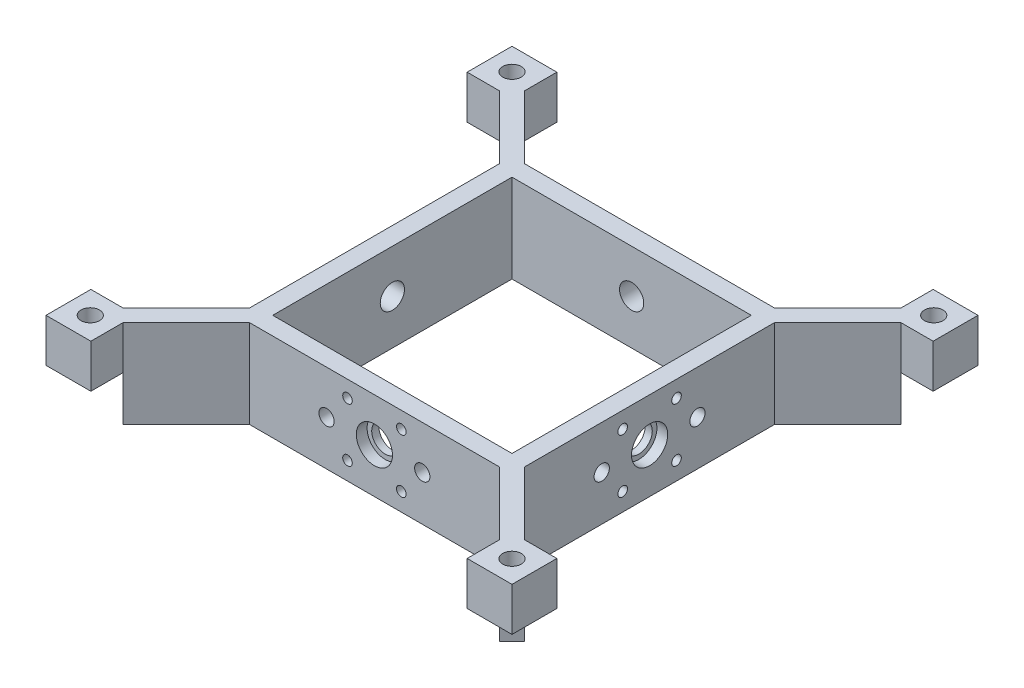
from build123d import *

# Parameters (mm, degrees)
SKETCH_1_W               = 80
SKETCH_1_H               = 80
EXTRUDE_1_DEPTH          = 30
CUT_EXTRUDE_1_DEPTH      = 15
SKETCH_3_R               = 1.6
CUT_EXTRUDE_2_DEPTH      = 115.178894722
SKETCH_4_R               = 3.1
CUT_EXTRUDE_3_DEPTH      = 5
PATTERN_CIRCULAR_1_COUNT = 4
SKETCH_6_R               = 6.05
CUT_EXTRUDE_4_DEPTH      = 3.6
SKETCH_7_R               = 4.5
CUT_EXTRUDE_5_DEPTH      = 2.5
SKETCH_8_R               = 2.55
CUT_EXTRUDE_6_DEPTH      = 6
SKETCH_9_R               = 1.6
CUT_EXTRUDE_7_DEPTH      = 6
PATTERN_CIRCULAR_2_COUNT = 2
PATTERN_CIRCULAR_2_ANGLE = 90
SKETCH_10_R              = 4.05
CUT_EXTRUDE_8_DEPTH      = 6
PATTERN_CIRCULAR_3_COUNT = 2
PATTERN_CIRCULAR_3_ANGLE = 90
CUT_EXTRUDE_9_DEPTH      = 0.5


with BuildPart() as part:
    # 草图1 → 凸台-拉伸1 (new body)
    with BuildSketch(Plane(origin=(0, 0, 0), x_dir=(1, 0, 0), z_dir=(0, 1, 0))):
        Polygon((-77.9, 77.9), (-62.9, 77.9), (-62.9, 67.142640687), (-41.757359313, 46), (41.757359313, 46), (62.9, 67.142640687), (62.9, 77.9), (77.9, 77.9), (77.9, 62.9), (67.142640687, 62.9), (46, 41.757359313), (46, -41.757359313), (67.142640687, -62.9), (77.9, -62.9), (77.9, -77.9), (62.9, -77.9), (62.9, -67.142640687), (41.757359313, -46), (-41.757359313, -46), (-62.9, -67.142640687), (-62.9, -77.9), (-77.9, -77.9), (-77.9, -62.9), (-67.142640687, -62.9), (-46, -41.757359313), (-46, 41.757359313), (-67.142640687, 62.9), (-77.9, 62.9), align=None)
        Rectangle(SKETCH_1_W, SKETCH_1_H, mode=Mode.SUBTRACT)
    extrude(amount=EXTRUDE_1_DEPTH)

    # 草图2 → 切除-拉伸1 (cut)
    with BuildSketch(Plane(origin=(0, 0, 0), x_dir=(1, 0, 0), z_dir=(0, 1, 0))):
        Polygon((-77.9, 77.9), (-62.9, 77.9), (-62.9, 67.142640687), (-67.142640687, 62.9), (-77.9, 62.9), align=None)
        Polygon((62.9, 77.9), (77.9, 77.9), (77.9, 62.9), (67.142640687, 62.9), (62.9, 67.142640687), align=None)
        Polygon((77.9, -62.9), (77.9, -77.9), (62.9, -77.9), (62.9, -67.142640687), (67.142640687, -62.9), align=None)
        Polygon((-62.9, -77.9), (-77.9, -77.9), (-77.9, -62.9), (-67.142640687, -62.9), (-62.9, -67.142640687), align=None)
    extrude(amount=CUT_EXTRUDE_1_DEPTH, mode=Mode.SUBTRACT)

    # 草图3 → 切除-拉伸2 (cut, through all)
    with BuildSketch(Plane(origin=(0, 30, 0), x_dir=(1, 0, 0), z_dir=(0, 1, 0))):
        with Locations(Location((-70.5, 70.5, 0), (0, 0, 270))):
            Circle(SKETCH_3_R)
    cut_extrude_2 = extrude(amount=-CUT_EXTRUDE_2_DEPTH, mode=Mode.SUBTRACT)

    # 草图4 → 切除-拉伸3 (cut)
    with BuildSketch(Plane(origin=(0, 30, 0), x_dir=(1, 0, 0), z_dir=(0, 1, 0))):
        with Locations(Location((-70.5, 70.5, 0), (0, 0, 270))):
            Circle(SKETCH_4_R)
    cut_extrude_3 = extrude(amount=-CUT_EXTRUDE_3_DEPTH, mode=Mode.SUBTRACT)

    # 阵列(圆周)1: 切除-拉伸2, 切除-拉伸3 ×4 about axis
    pattern_circular_1_axis = Axis((0, 0, 0), (0, 1, 0))
    add([cut_extrude_2.rotate(pattern_circular_1_axis, i * 360 / PATTERN_CIRCULAR_1_COUNT) for i in range(1, PATTERN_CIRCULAR_1_COUNT)], mode=Mode.SUBTRACT)
    add([cut_extrude_3.rotate(pattern_circular_1_axis, i * 360 / PATTERN_CIRCULAR_1_COUNT) for i in range(1, PATTERN_CIRCULAR_1_COUNT)], mode=Mode.SUBTRACT)

    # 草图6 → 切除-拉伸4 (cut)
    with BuildSketch(Plane.XY.offset(46)):
        with Locations((0, 15)):
            Circle(SKETCH_6_R)
    cut_extrude_4 = extrude(amount=-CUT_EXTRUDE_4_DEPTH, mode=Mode.SUBTRACT)

    # 草图7 → 切除-拉伸5 (cut)
    with BuildSketch(Plane.XY.offset(42.4)):
        with Locations((0, 15)):
            Circle(SKETCH_7_R)
    cut_extrude_5 = extrude(amount=-CUT_EXTRUDE_5_DEPTH, mode=Mode.SUBTRACT)

    # 草图8 → 切除-拉伸6 (cut)
    with BuildSketch(Plane.XY.offset(46)):
        with Locations((-16, 15)):
            Circle(SKETCH_8_R)
        with Locations(Location((16, 15, 0), (0, 0, 180))):
            Circle(SKETCH_8_R)
    cut_extrude_6 = extrude(amount=-CUT_EXTRUDE_6_DEPTH, mode=Mode.SUBTRACT)

    # 草图9 → 切除-拉伸7 (cut)
    with BuildSketch(Plane.XY.offset(46)):
        with Locations((9, 24)):
            Circle(SKETCH_9_R)
        with Locations((9, 6)):
            Circle(SKETCH_9_R)
        with Locations((-9, 6)):
            Circle(SKETCH_9_R)
        with Locations((-9, 24)):
            Circle(SKETCH_9_R)
    cut_extrude_7 = extrude(amount=-CUT_EXTRUDE_7_DEPTH, mode=Mode.SUBTRACT)

    # 阵列(圆周)2: 切除-拉伸4, 切除-拉伸5, 切除-拉伸6, 切除-拉伸7 ×2 about axis
    pattern_circular_2_axis = Axis((0, 0, 0), (0, 1, 0))
    add([cut_extrude_4.rotate(pattern_circular_2_axis, i * PATTERN_CIRCULAR_2_ANGLE / (PATTERN_CIRCULAR_2_COUNT - 1)) for i in range(1, PATTERN_CIRCULAR_2_COUNT)], mode=Mode.SUBTRACT)
    add([cut_extrude_5.rotate(pattern_circular_2_axis, i * PATTERN_CIRCULAR_2_ANGLE / (PATTERN_CIRCULAR_2_COUNT - 1)) for i in range(1, PATTERN_CIRCULAR_2_COUNT)], mode=Mode.SUBTRACT)
    add([cut_extrude_6.rotate(pattern_circular_2_axis, i * PATTERN_CIRCULAR_2_ANGLE / (PATTERN_CIRCULAR_2_COUNT - 1)) for i in range(1, PATTERN_CIRCULAR_2_COUNT)], mode=Mode.SUBTRACT)
    add([cut_extrude_7.rotate(pattern_circular_2_axis, i * PATTERN_CIRCULAR_2_ANGLE / (PATTERN_CIRCULAR_2_COUNT - 1)) for i in range(1, PATTERN_CIRCULAR_2_COUNT)], mode=Mode.SUBTRACT)

    # 草图10 → 切除-拉伸8 (cut)
    with BuildSketch(Plane.ZY.offset(46)):
        with Locations((0, 15)):
            Circle(SKETCH_10_R)
    cut_extrude_8 = extrude(amount=-CUT_EXTRUDE_8_DEPTH, mode=Mode.SUBTRACT)

    # 阵列(圆周)3: 切除-拉伸8 ×2 about axis
    pattern_circular_3_axis = Axis((0, 0, 0), (0, -1, 0))
    for i in range(1, PATTERN_CIRCULAR_3_COUNT):
        add(cut_extrude_8.rotate(pattern_circular_3_axis, i * PATTERN_CIRCULAR_3_ANGLE / (PATTERN_CIRCULAR_3_COUNT - 1)), mode=Mode.SUBTRACT)

    # 草图11 → 切除-拉伸9 (cut)
    with BuildSketch(Plane(origin=(0, 30, 0), x_dir=(1, 0, 0), z_dir=(0, 1, 0))):
        Polygon((-77.9, 77.9), (-77.9, 62.9), (-67.142640687, 62.9), (-46, 41.757359313), (-46, -41.757359313), (-67.142640687, -62.9), (-77.9, -62.9), (-77.9, -77.9), (-62.9, -77.9), (-62.9, -67.142640687), (-41.757359313, -46), (41.757359313, -46), (62.9, -67.142640687), (62.9, -77.9), (77.9, -77.9), (77.9, -62.9), (67.142640687, -62.9), (46, -41.757359313), (46, 41.757359313), (67.142640687, 62.9), (77.9, 62.9), (77.9, 77.9), (62.9, 77.9), (62.9, 67.142640687), (41.757359313, 46), (-41.757359313, 46), (-62.9, 67.142640687), (-62.9, 77.9), align=None)
    extrude(amount=-CUT_EXTRUDE_9_DEPTH, mode=Mode.SUBTRACT)


solid = part.part
